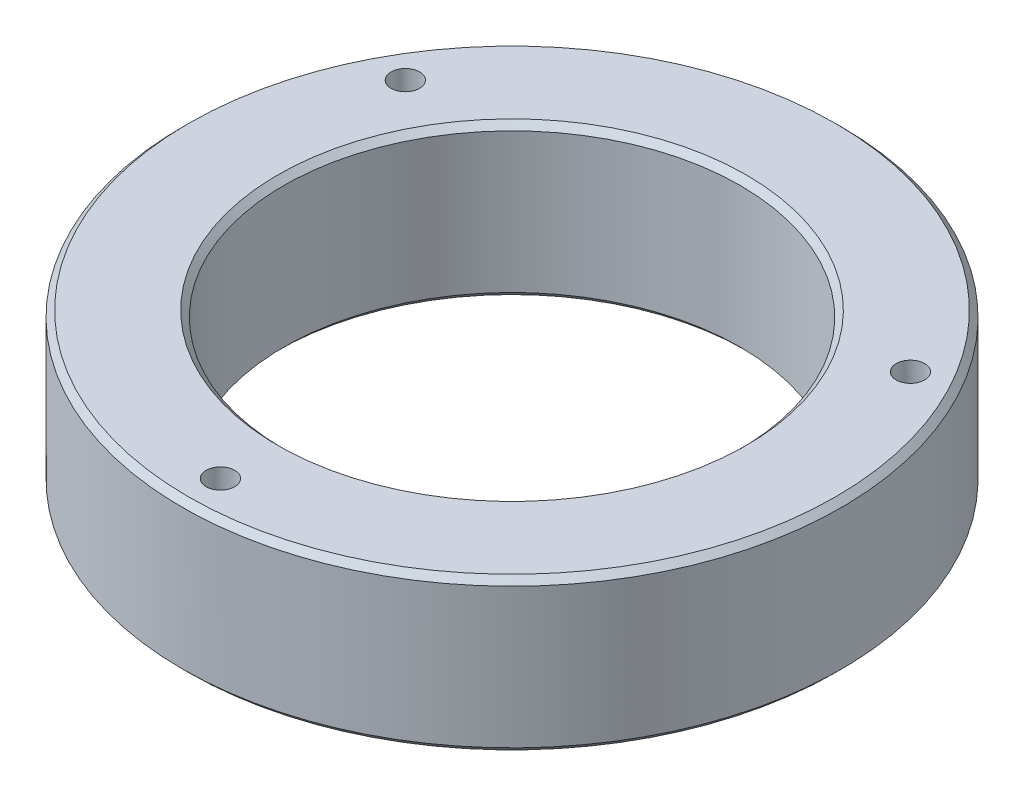
from build123d import *

# Parameters (mm, degrees)
SKETCH1_W                   = 38.1
SKETCH1_H                   = 25.3746
CHAMFER1_SIZE               = 1.524
CUT_EXTRUDE2_START          = -19.05
SKETCH6_R                   = 3.5687
CUT_EXTRUDE2_DEPTH          = 76.2
CUT_EXTRUDE4_START          = -19.05
SKETCH7_R                   = 5.5626
CUT_EXTRUDE4_DEPTH          = 9.652
F_3_8_16_TAPPED_HOLE2_D     = 7.9375
F_3_8_16_TAPPED_HOLE2_DEPTH = 25.4
F_3_8_16_TAPPED_HOLE2_TIP   = 2.384665582


with BuildPart() as part:
    # Sketch1 → Revolve1 (revolve)
    with BuildSketch(Plane(origin=(0, 0, 0), x_dir=(0, 1, 0), z_dir=(0, 0, 1)), mode=Mode.PRIVATE) as revolve1_sk:
        with Locations((0, 69.8373)):
            Rectangle(SKETCH1_W, SKETCH1_H)
    revolve(revolve1_sk.sketch.rotate(Axis((0, -44.45, 0), (0, 1, 0)), 270), axis=Axis((0, -44.45, 0), (0, 1, 0)))

    # Chamfer1
    chamfer1_edges = [part.edges().sort_by_distance(p)[0] for p in [
        (0, -19.05, 57.15),
        (0, 19.05, 57.15),
        (0, 19.05, 82.5246),
        (0, -19.05, 82.5246),
    ]]
    chamfer(chamfer1_edges, length=CHAMFER1_SIZE)

    # Sketch6 → Cut-Extrude2 (cut)
    with BuildSketch(Plane(origin=(0, 0, 0), x_dir=(-1, 0, 0), z_dir=(0, 1, 0)).offset(CUT_EXTRUDE2_START)):
        with Locations(Location((0, 73.025, 0), (0, 0, 270))):
            Circle(SKETCH6_R)
        with Locations(Location((-63.246, -36.5252, 0), (0, 0, 270))):
            Circle(SKETCH6_R)
        with Locations(Location((63.246, -36.5252, 0), (0, 0, 270))):
            Circle(SKETCH6_R)
    extrude(amount=CUT_EXTRUDE2_DEPTH, mode=Mode.SUBTRACT)

    # Sketch7 → Cut-Extrude4 (cut)
    with BuildSketch(Plane(origin=(0, 0, 0), x_dir=(-1, 0, 0), z_dir=(0, 1, 0)).offset(CUT_EXTRUDE4_START)):
        with Locations(Location((0, 73.025, 0), (0, 0, 90))):
            Circle(SKETCH7_R)
        with Locations(Location((-63.246, -36.5252, 0), (0, 0, 90))):
            Circle(SKETCH7_R)
        with Locations(Location((63.246, -36.5252, 0), (0, 0, 90))):
            Circle(SKETCH7_R)
    extrude(amount=CUT_EXTRUDE4_DEPTH, mode=Mode.SUBTRACT)

    # 3/8-16 Tapped Hole2
    with Locations(Plane(origin=(0, -19.05, 0), x_dir=(-1, 0, 0), z_dir=(0, -1, 0))):
        with Locations((-69.85, 0), (69.85, 0)):
            Hole(F_3_8_16_TAPPED_HOLE2_D / 2, depth=F_3_8_16_TAPPED_HOLE2_DEPTH)
            with Locations((0, 0, -(F_3_8_16_TAPPED_HOLE2_DEPTH + F_3_8_16_TAPPED_HOLE2_TIP / 2))):  # 118° drill point
                Cone(0, F_3_8_16_TAPPED_HOLE2_D / 2, F_3_8_16_TAPPED_HOLE2_TIP, mode=Mode.SUBTRACT)


solid = part.part
